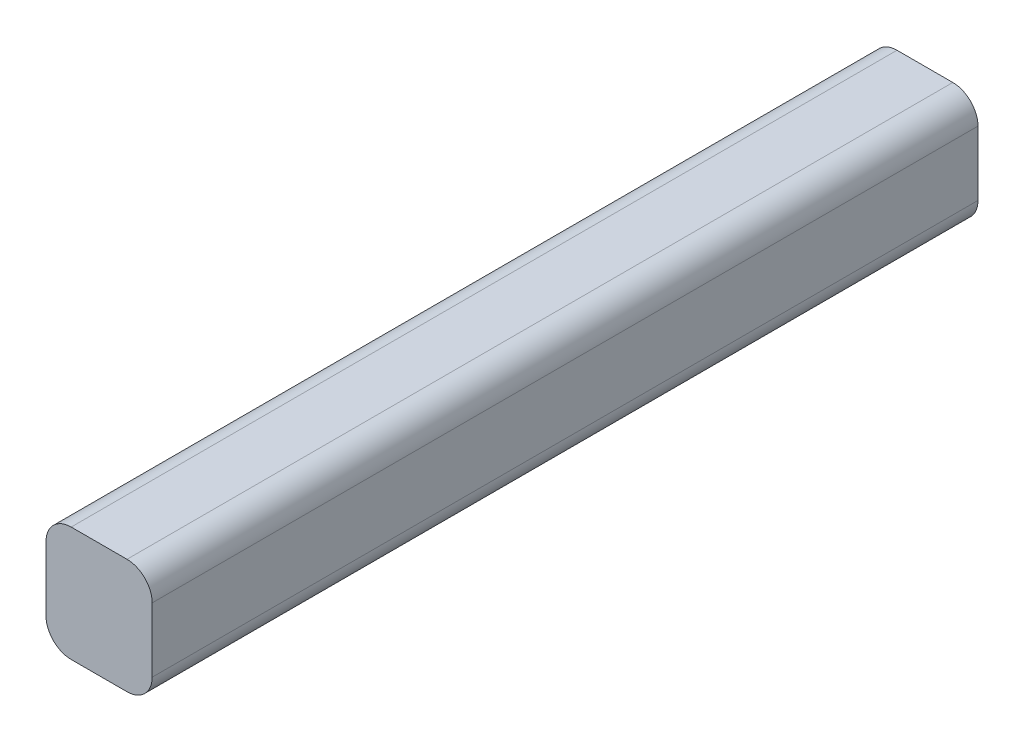
from build123d import *

# Parameters (mm, degrees)
SKETCH1_W           = 42.17
SKETCH1_H           = 45.57
BOSS_EXTRUDE1_DEPTH = 328
FILLET1_R           = 10


with BuildPart() as part:
    # Sketch1 → Boss-Extrude1 (new body)
    with BuildSketch(Plane.XY):
        with Locations((1.695, -0.005)):
            Rectangle(SKETCH1_W, SKETCH1_H)
    extrude(amount=BOSS_EXTRUDE1_DEPTH)

    # Fillet1
    fillet1_edges = [part.edges().sort_by_distance(p)[0] for p in [
        (22.78, 22.78, 164),
        (22.78, -22.79, 164),
        (-19.39, -22.79, 164),
        (-19.39, 22.78, 164),
    ]]
    fillet(fillet1_edges, radius=FILLET1_R)


solid = part.part
